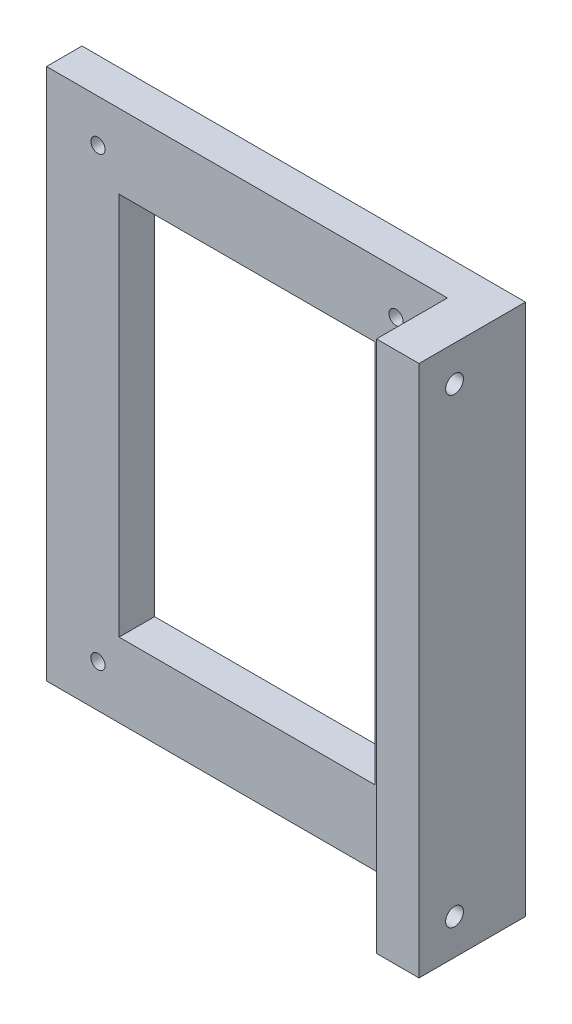
from build123d import *

# Parameters (mm, degrees)
SKETCH_1_W          = 113
SKETCH_1_H          = 150
SKETCH_1_R          = 2
SKETCH_1_W_2        = 72.084054685
SKETCH_1_H_2        = 108.126082027
EXTRUDE_1_DEPTH     = 10
SKETCH_2_W          = 30
SKETCH_2_H          = 150
EXTRUDE_2_DEPTH     = 12
SKETCH_3_R          = 2.5
CUT_EXTRUDE_2_DEPTH = 12
SKETCH_6_R          = 4.5
CUT_EXTRUDE_5_DEPTH = 5


with BuildPart() as part:
    # 草图1 → 凸台-拉伸1 (new body)
    with BuildSketch(Plane.XY):
        with Locations((36.884615385, -26.807692308)):
            Rectangle(SKETCH_1_W, SKETCH_1_H)
        with Locations((78.884615385, 36.192307692)):
            Circle(SKETCH_1_R, mode=Mode.SUBTRACT)
        with Locations((-5.115384615, 36.192307692)):
            Circle(SKETCH_1_R, mode=Mode.SUBTRACT)
        with Locations((78.884615385, -89.807692308)):
            Circle(SKETCH_1_R, mode=Mode.SUBTRACT)
        with Locations((-5.115384615, -89.807692308)):
            Circle(SKETCH_1_R, mode=Mode.SUBTRACT)
        with Locations((36.884615385, -26.807692307)):
            Rectangle(SKETCH_1_W_2, SKETCH_1_H_2, mode=Mode.SUBTRACT)
    extrude(amount=EXTRUDE_1_DEPTH)

    # 草图2 → 凸台-拉伸2 (add)
    with BuildSketch(Plane(origin=(93.384615385, 0, 0), x_dir=(0, 0, -1), z_dir=(1, 0, 0))):
        with Locations((-15, -26.807692308)):
            Rectangle(SKETCH_2_W, SKETCH_2_H)
    extrude(amount=EXTRUDE_2_DEPTH)

    # 草图3 → 切除-拉伸2 (cut)
    with BuildSketch(Plane.ZY.offset(-93.384615385)):
        with Locations(Location((20, 38.192307692, 0), (0, 0, 270))):
            Circle(SKETCH_3_R)
        with Locations(Location((20, -91.807692308, 0), (0, 0, 90))):
            Circle(SKETCH_3_R)
    extrude(amount=-CUT_EXTRUDE_2_DEPTH, mode=Mode.SUBTRACT)

    # 草图6 → 切除-拉伸5 (cut)
    with BuildSketch(Plane.ZY.offset(-93.384615385)):
        with Locations(Location((20, 38.192307692, 0), (0, 0, 270))):
            Circle(SKETCH_6_R)
        with Locations(Location((20, -91.807692308, 0), (0, 0, 90))):
            Circle(SKETCH_6_R)
    extrude(amount=-CUT_EXTRUDE_5_DEPTH, mode=Mode.SUBTRACT)


solid = part.part
